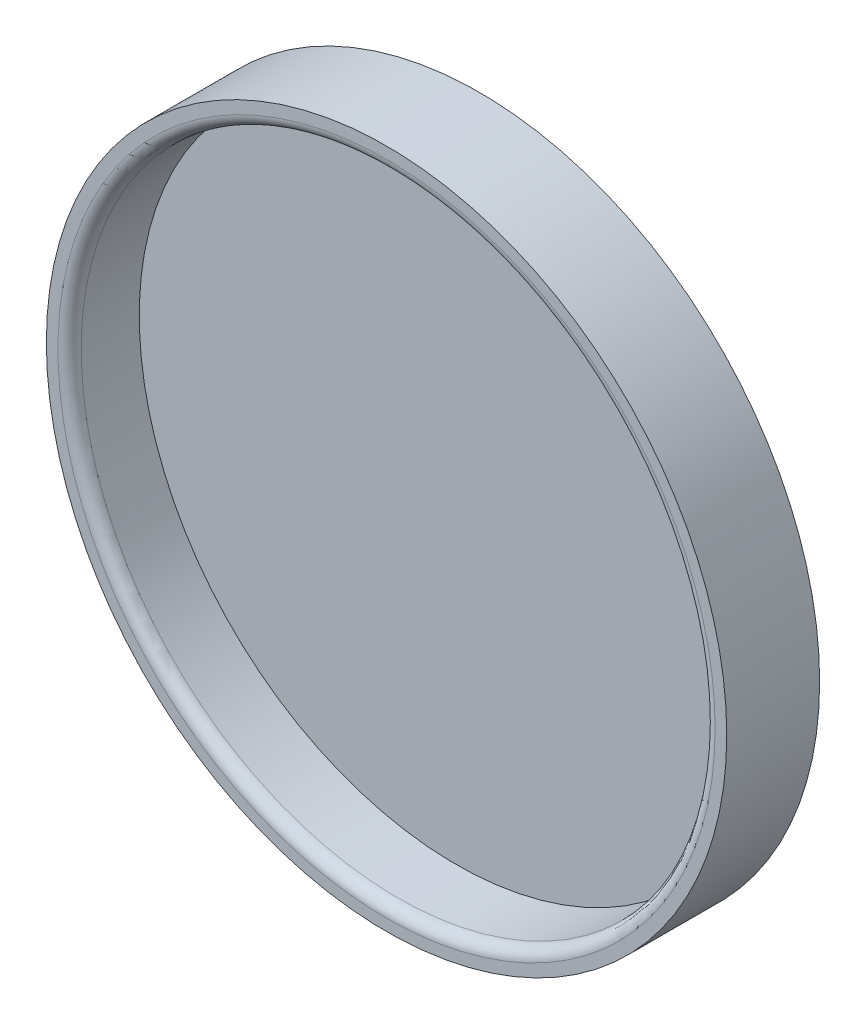
from build123d import *

# Parameters (mm, degrees)
SKETCH1_R           = 14.65
BOSS_EXTRUDE1_DEPTH = 1
SKETCH2_R           = 14.65
SKETCH2_R_2         = 13.65
BOSS_EXTRUDE2_DEPTH = 3
FILLET1_R           = 0.5


with BuildPart() as part:
    # Sketch1 → Boss-Extrude1 (new body)
    with BuildSketch(Plane.XY):
        Circle(SKETCH1_R)
    extrude(amount=BOSS_EXTRUDE1_DEPTH)

    # Sketch2 → Boss-Extrude2 (add)
    with BuildSketch(Plane.XY.offset(1)):
        Circle(SKETCH2_R)
        Circle(SKETCH2_R_2, mode=Mode.SUBTRACT)
    extrude(amount=BOSS_EXTRUDE2_DEPTH)

    # Fillet1
    fillet1_edges = [part.edges().sort_by_distance(p)[0] for p in [
        (-13.65, 0, 4),
    ]]
    fillet(fillet1_edges, radius=FILLET1_R)


solid = part.part
